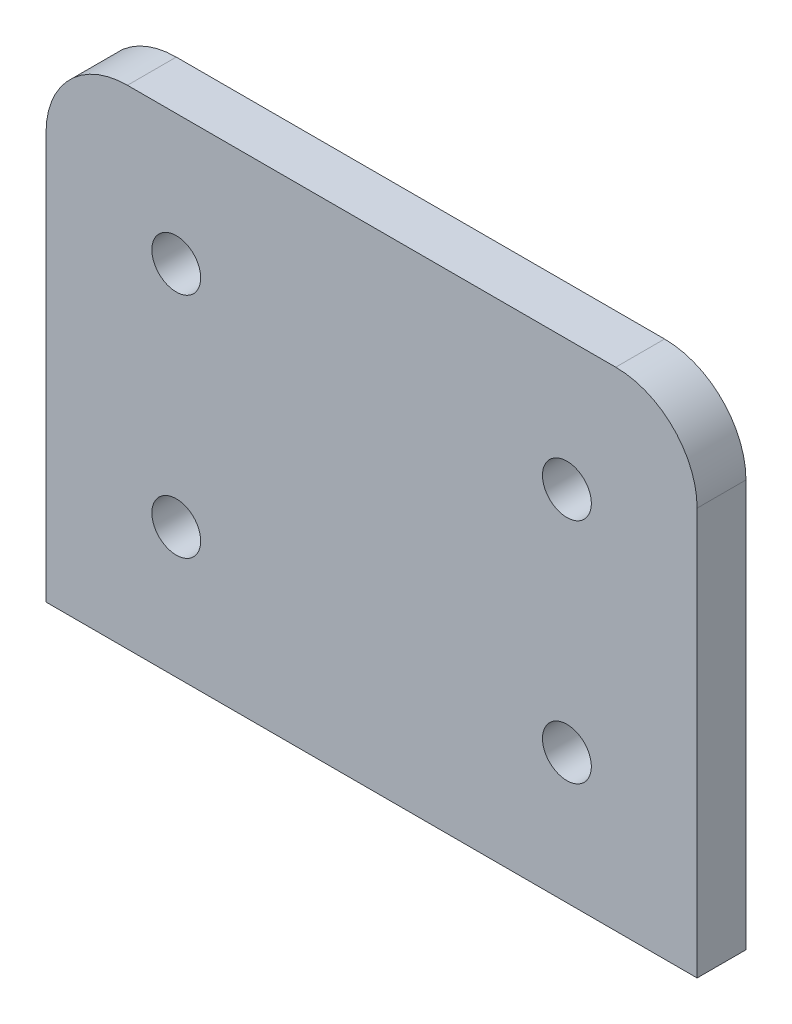
from build123d import *

# Parameters (mm, degrees)
SKETCH_1_W      = 40
SKETCH_1_H      = 30
SKETCH_1_R      = 1.5
EXTRUDE_1_DEPTH = 3
FILLET_1_R      = 5


with BuildPart() as part:
    # 草圖1 → 填料-伸長1 (new body)
    with BuildSketch(Plane.XY):
        Rectangle(SKETCH_1_W, SKETCH_1_H)
        with Locations((-12, 7)):
            Circle(SKETCH_1_R, mode=Mode.SUBTRACT)
        with Locations((-12, -7)):
            Circle(SKETCH_1_R, mode=Mode.SUBTRACT)
        with Locations(Location((12, -7, 0), (0, 0, 180))):
            Circle(SKETCH_1_R, mode=Mode.SUBTRACT)
        with Locations(Location((12, 7, 0), (0, 0, 180))):
            Circle(SKETCH_1_R, mode=Mode.SUBTRACT)
    extrude(amount=EXTRUDE_1_DEPTH)

    # 圓角1
    fillet_1_edges = [part.edges().sort_by_distance(p)[0] for p in [
        (-20, 15, 1.5),
        (20, 15, 1.5),
    ]]
    fillet(fillet_1_edges, radius=FILLET_1_R)


solid = part.part
